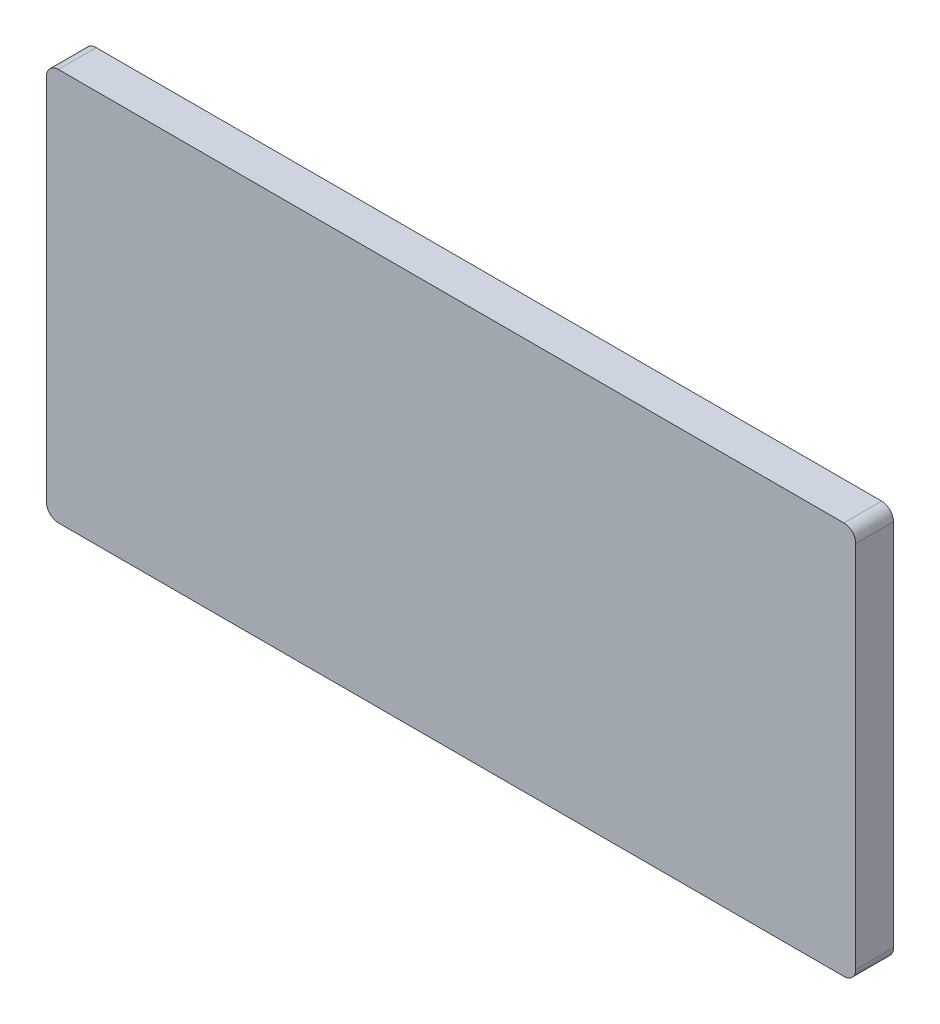
from build123d import *

# Parameters (mm, degrees)
SKETCH1_W           = 68
SKETCH1_H           = 33
BOSS_EXTRUDE1_DEPTH = 3.175
FILLET1_R           = 1
SKETCH2_R           = 2.15
SKETCH2_R_2         = 1.7
CUT_EXTRUDE2_DEPTH  = 1.25


with BuildPart() as part:
    # Sketch1 → Boss-Extrude1 (new body)
    with BuildSketch(Plane.XY):
        Rectangle(SKETCH1_W, SKETCH1_H)
    extrude(amount=BOSS_EXTRUDE1_DEPTH)

    # Fillet1
    fillet1_edges = [part.edges().sort_by_distance(p)[0] for p in [
        (34, 16.5, 1.5875),
        (34, -16.5, 1.5875),
        (-34, -16.5, 1.5875),
        (-34, 16.5, 1.5875),
    ]]
    fillet(fillet1_edges, radius=FILLET1_R)

    # Sketch2 → Cut-Extrude2 (cut)
    with BuildSketch(Plane(origin=(0, 0, 0), x_dir=(-1, 0, 0), z_dir=(0, 0, -1))):
        with Locations((20.5, 0)):
            Circle(SKETCH2_R)
        with Locations((31.75, -14.25)):
            Circle(SKETCH2_R_2)
        with Locations(Location((31.75, 14.25, 0), (0, 0, 180))):
            Circle(SKETCH2_R_2)
        with BuildLine():
            Line((-31.75, 15.95), (-29.25, 15.95))
            ThreePointArc((-29.25, 15.95), (-27.55, 14.25), (-29.25, 12.55))
            Line((-29.25, 12.55), (-31.75, 12.55))
            ThreePointArc((-31.75, 12.55), (-33.45, 14.25), (-31.75, 15.95))
        make_face()
        with BuildLine():
            Line((-31.75, -15.95), (-29.25, -15.95))
            ThreePointArc((-29.25, -15.95), (-27.55, -14.25), (-29.25, -12.55))
            Line((-29.25, -12.55), (-31.75, -12.55))
            ThreePointArc((-31.75, -12.55), (-33.45, -14.25), (-31.75, -15.95))
        make_face()
        with BuildLine():
            Line((-20.5, 2.15), (-17.5, 2.15))
            ThreePointArc((-17.5, 2.15), (-15.35, 0), (-17.5, -2.15))
            Line((-17.5, -2.15), (-20.5, -2.15))
            ThreePointArc((-20.5, -2.15), (-22.65, 0), (-20.5, 2.15))
        make_face()
    extrude(amount=-CUT_EXTRUDE2_DEPTH, mode=Mode.SUBTRACT)


solid = part.part
